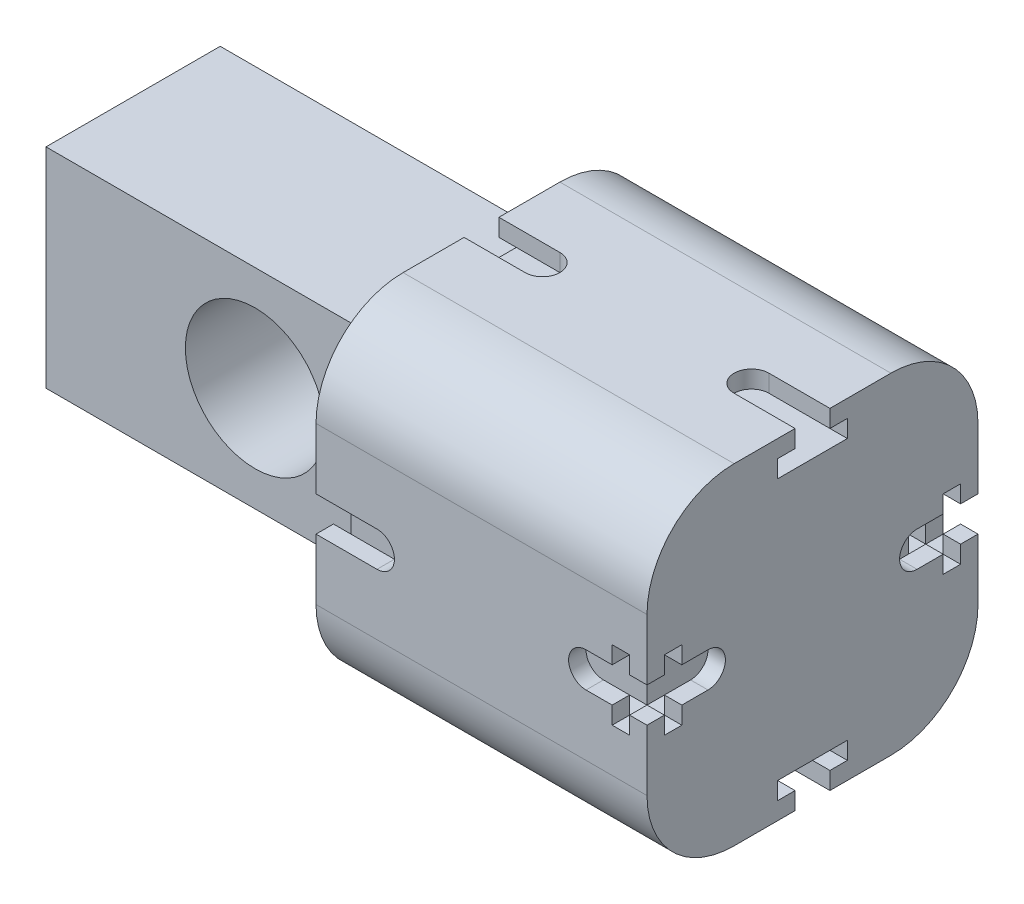
from build123d import *

# Parameters (mm, degrees)
SKETCH_2_W           = 19
SKETCH_2_H           = 19
EXTRUDE_1_DEPTH      = 9.5
FILLET_1_R           = 5
FILLET_2_R           = 5
SKETCH_7_W           = 5.5
SKETCH_7_H           = 4
CUT_EXTRUDE_5_DEPTH  = 1
CUT_EXTRUDE_6_DEPTH  = 1
SKETCH_13_W          = 5.5
SKETCH_13_H          = 4
CUT_EXTRUDE_10_DEPTH = 1
SKETCH_14_W          = 5.5
SKETCH_14_H          = 4
CUT_EXTRUDE_11_DEPTH = 1
SKETCH_15_W          = 5.5
SKETCH_15_H          = 4
CUT_EXTRUDE_12_DEPTH = 1
CUT_EXTRUDE_13_DEPTH = 2
CUT_EXTRUDE_14_DEPTH = 2
CUT_EXTRUDE_START    = 2
CUT_EXTRUDE_15_DEPTH = 2
SKETCH_23_W          = 5.5
SKETCH_23_H          = 4
CUT_EXTRUDE_16_DEPTH = 1
CUT_EXTRUDE_17_DEPTH = 2
SKETCH_27_W          = 10
SKETCH_27_H          = 12
EXTRUDE_2_DEPTH      = 20
SKETCH_28_R          = 4
CUT_EXTRUDE_20_DEPTH = 10


with BuildPart() as part:
    # 草图2 → 凸台-拉伸1 (new, symmetric)
    with BuildSketch(Plane.XY):
        Rectangle(SKETCH_2_W, SKETCH_2_H)
    extrude(amount=EXTRUDE_1_DEPTH, both=True)

    # 圆角1
    fillet_1_edges = [part.edges().sort_by_distance(p)[0] for p in [
        (0, 9.5, 9.5),
    ]]
    fillet(fillet_1_edges, radius=FILLET_1_R)

    # 圆角2
    fillet_2_edges = [part.edges().sort_by_distance(p)[0] for p in [
        (0, -9.5, 9.5),
        (0, -9.5, -9.5),
        (0, 9.5, -9.5),
    ]]
    fillet(fillet_2_edges, radius=FILLET_2_R)

    # 草图7 → 切除-拉伸5 (cut)
    with BuildSketch(Plane(origin=(0, -7.5, 0), x_dir=(-1, 0, 0), z_dir=(0, -1, 0))):
        with Locations((-6.75, 0)):
            Rectangle(SKETCH_7_W, SKETCH_7_H)
        with Locations((6.75, 0)):
            Rectangle(SKETCH_7_W, SKETCH_7_H)
    extrude(amount=CUT_EXTRUDE_5_DEPTH, mode=Mode.SUBTRACT)

    # 草图9 → 切除-拉伸6 (cut)
    with BuildSketch(Plane.XZ.offset(9.5)):
        with BuildLine():
            Line((6, 1), (9.5, 1))
            Line((9.5, 1), (9.5, -1))
            Line((9.5, -1), (6, -1))
            ThreePointArc((6, -1), (5, 0), (6, 1))
        make_face()
        with BuildLine():
            Line((-9.5, 1), (-9.5, -1))
            Line((-9.5, -1), (-6, -1))
            ThreePointArc((-6, -1), (-5, 0), (-6, 1))
            Line((-6, 1), (-9.5, 1))
        make_face()
    extrude(amount=-CUT_EXTRUDE_6_DEPTH, mode=Mode.SUBTRACT)

    # 草图13 → 切除-拉伸10 (cut)
    with BuildSketch(Plane.XY.offset(7.5)):
        with Locations((-6.75, 0)):
            Rectangle(SKETCH_13_W, SKETCH_13_H)
        with Locations((6.75, 0)):
            Rectangle(SKETCH_13_W, SKETCH_13_H)
    extrude(amount=CUT_EXTRUDE_10_DEPTH, mode=Mode.SUBTRACT)

    # 草图14 → 切除-拉伸11 (cut)
    with BuildSketch(Plane(origin=(0, 7.5, 0), x_dir=(1, 0, 0), z_dir=(0, 1, 0))):
        with Locations((-6.75, 0)):
            Rectangle(SKETCH_14_W, SKETCH_14_H)
        with Locations((6.75, 0)):
            Rectangle(SKETCH_14_W, SKETCH_14_H)
    extrude(amount=CUT_EXTRUDE_11_DEPTH, mode=Mode.SUBTRACT)

    # 草图15 → 切除-拉伸12 (cut)
    with BuildSketch(Plane(origin=(0, 0, -7.5), x_dir=(-1, 0, 0), z_dir=(0, 0, -1))):
        with Locations((-6.75, 0)):
            Rectangle(SKETCH_15_W, SKETCH_15_H)
        with Locations((6.75, 0)):
            Rectangle(SKETCH_15_W, SKETCH_15_H)
    extrude(amount=CUT_EXTRUDE_12_DEPTH, mode=Mode.SUBTRACT)

    # 草图20 → 切除-拉伸13 (cut)
    with BuildSketch(Plane(origin=(0, 0, 7.5), x_dir=(-1, 0, 0), z_dir=(0, 0, 1))):
        with BuildLine():
            Line((6, 1), (9.5, 1))
            Line((9.5, 1), (9.5, -1))
            Line((9.5, -1), (6, -1))
            ThreePointArc((6, -1), (5, 0), (6, 1))
        make_face()
        with BuildLine():
            Line((-9.5, 1), (-9.5, -1))
            Line((-9.5, -1), (-6, -1))
            ThreePointArc((-6, -1), (-5, 0), (-6, 1))
            Line((-6, 1), (-9.5, 1))
        make_face()
    extrude(amount=CUT_EXTRUDE_13_DEPTH, mode=Mode.SUBTRACT)

    # 草图21 → 切除-拉伸14 (cut)
    with BuildSketch(Plane(origin=(0, 7.5, 0), x_dir=(-1, 0, 0), z_dir=(0, 1, 0))):
        with BuildLine():
            Line((6, 1), (9.5, 1))
            Line((9.5, 1), (9.5, -1))
            Line((9.5, -1), (6, -1))
            ThreePointArc((6, -1), (5, 0), (6, 1))
        make_face()
        with BuildLine():
            Line((-9.5, 1), (-9.5, -1))
            Line((-9.5, -1), (-6, -1))
            ThreePointArc((-6, -1), (-5, 0), (-6, 1))
            Line((-6, 1), (-9.5, 1))
        make_face()
    extrude(amount=CUT_EXTRUDE_14_DEPTH, mode=Mode.SUBTRACT)

    # 草图22 → 切除-拉伸15 (cut)
    with BuildSketch(Plane(origin=(0, 0, -7.5), x_dir=(1, 0, 0), z_dir=(0, 0, -1)).offset(CUT_EXTRUDE_START)):
        with BuildLine():
            Line((6, 1), (9.5, 1))
            Line((9.5, 1), (9.5, -1))
            Line((9.5, -1), (6, -1))
            ThreePointArc((6, -1), (5, 0), (6, 1))
        make_face()
        with BuildLine():
            Line((-9.5, 1), (-9.5, -1))
            Line((-9.5, -1), (-6, -1))
            ThreePointArc((-6, -1), (-5, 0), (-6, 1))
            Line((-6, 1), (-9.5, 1))
        make_face()
    extrude(amount=-CUT_EXTRUDE_15_DEPTH, mode=Mode.SUBTRACT)

    # 草图23 → 切除-拉伸16 (cut)
    with BuildSketch(Plane(origin=(7.5, 0, 0), x_dir=(0, 0, -1), z_dir=(1, 0, 0))):
        with Locations((-6.75, 0)):
            Rectangle(SKETCH_23_W, SKETCH_23_H)
        with Locations((6.75, 0)):
            Rectangle(SKETCH_23_W, SKETCH_23_H)
    extrude(amount=CUT_EXTRUDE_16_DEPTH, mode=Mode.SUBTRACT)

    # 草图24 → 切除-拉伸17 (cut)
    with BuildSketch(Plane(origin=(7.5, 0, 0), x_dir=(0, 0, 1), z_dir=(1, 0, 0))):
        with BuildLine():
            Line((6, 1), (9.5, 1))
            Line((9.5, 1), (9.5, -1))
            Line((9.5, -1), (6, -1))
            ThreePointArc((6, -1), (5, 0), (6, 1))
        make_face()
        with BuildLine():
            Line((-9.5, 1), (-9.5, -1))
            Line((-9.5, -1), (-6, -1))
            ThreePointArc((-6, -1), (-5, 0), (-6, 1))
            Line((-6, 1), (-9.5, 1))
        make_face()
    extrude(amount=CUT_EXTRUDE_17_DEPTH, mode=Mode.SUBTRACT)

    # 草图27 → 凸台-拉伸2 (add)
    with BuildSketch(Plane.ZY.offset(9.5)):
        Rectangle(SKETCH_27_W, SKETCH_27_H)
    extrude(amount=EXTRUDE_2_DEPTH)

    # 草图28 → 切除-拉伸20 (cut, symmetric)
    with BuildSketch(Plane.XY):
        with Locations(Location((-17.5, 0, 0), (0, 0, 270))):
            Circle(SKETCH_28_R)
    extrude(amount=CUT_EXTRUDE_20_DEPTH, both=True, mode=Mode.SUBTRACT)


solid = part.part
